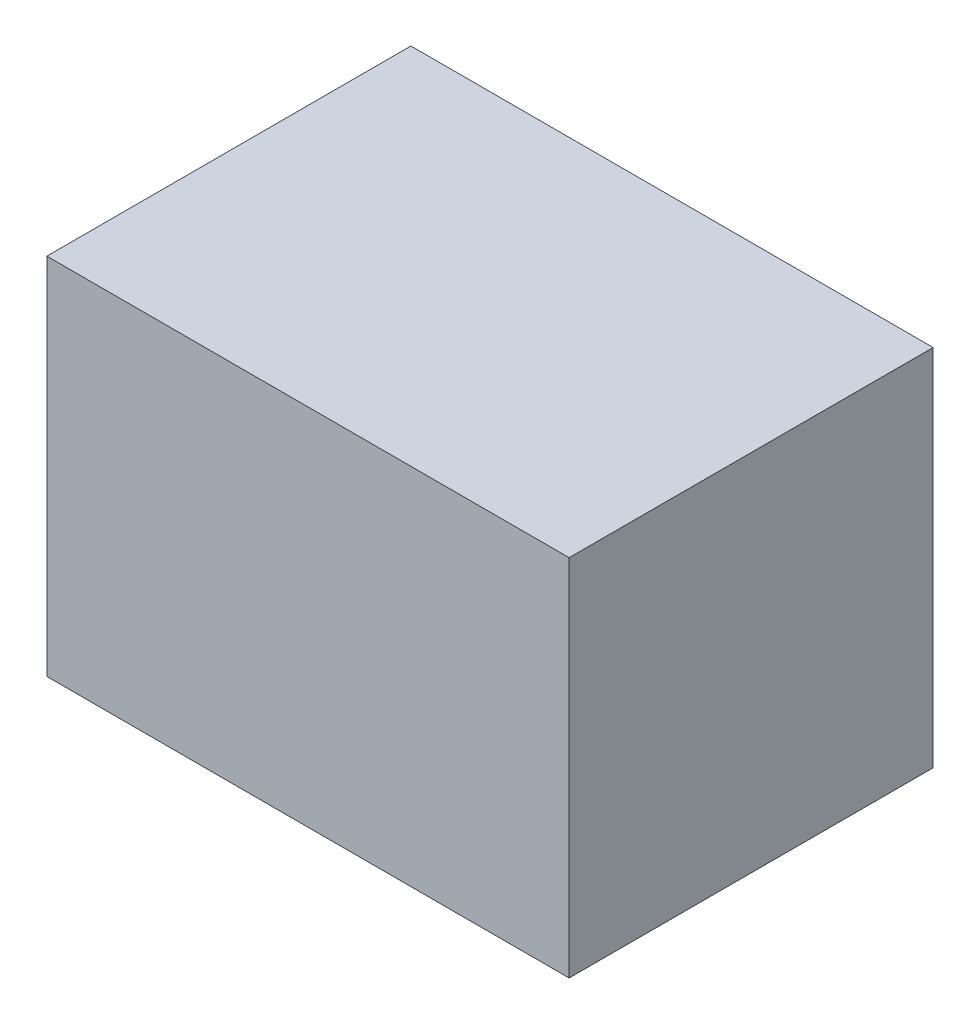
from build123d import *

# Parameters (mm, degrees)
SKETCH1_W           = 104.775
SKETCH1_H           = 73.025
BOSS_EXTRUDE1_DEPTH = 73.025


with BuildPart() as part:
    # Sketch1 → Boss-Extrude1 (new body)
    with BuildSketch(Plane.XY):
        with Locations((-107.380896226, -94.860613208)):
            Rectangle(SKETCH1_W, SKETCH1_H)
    extrude(amount=BOSS_EXTRUDE1_DEPTH)


solid = part.part
